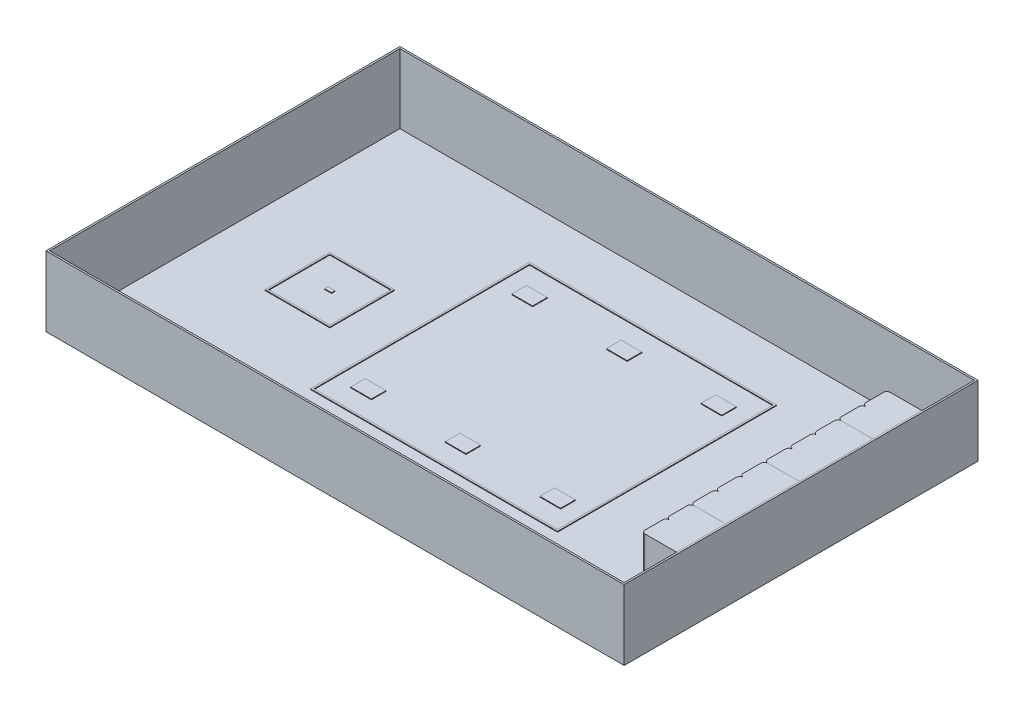
from build123d import *

# Parameters (mm, degrees)
SKETCH1_W                = 8200
SKETCH1_H                = 5000
SKETCH1_W_2              = 900
SKETCH1_H_2              = 900
SKETCH1_W_3              = 100
SKETCH1_H_3              = 50
SKETCH1_W_4              = 3500
SKETCH1_H_4              = 3100
SKETCH1_W_5              = 297
SKETCH1_H_5              = 210
BOSS_EXTRUDE1_DEPTH      = 10
EXTRUDE_THIN1_DEPTH      = 10
EXTRUDE_THIN1_DEPTH_BACK = 10
EXTRUDE_THIN1_START      = 10
SKETCH1_4_W              = 925
SKETCH1_4_H              = 925
SKETCH1_4_W_2            = 875
SKETCH1_4_H_2            = 875
BOSS_EXTRUDE3_START      = 10
SKETCH1_5_W              = 100
SKETCH1_5_H              = 50
BOSS_EXTRUDE3_DEPTH      = 10
SKETCH1_6_W              = 8250
SKETCH1_6_H              = 5050
SKETCH1_6_W_2            = 8200
SKETCH1_6_H_2            = 5000
EXTRUDE_THIN2_DEPTH      = 1000
BOSS_EXTRUDE4_START      = 10
SKETCH1_7_W              = 297
SKETCH1_7_H              = 210
BOSS_EXTRUDE4_DEPTH      = 10
BOSS_EXTRUDE4_2_DEPTH    = 10
BOSS_EXTRUDE4_3_DEPTH    = 10
BOSS_EXTRUDE4_4_DEPTH    = 10
BOSS_EXTRUDE4_5_DEPTH    = 10
BOSS_EXTRUDE4_6_DEPTH    = 10
BOSS_EXTRUDE6_START      = 10
BOSS_EXTRUDE6_DEPTH      = 990
BOSS_EXTRUDE7_START      = 10
BOSS_EXTRUDE7_DEPTH      = 990
BOSS_EXTRUDE8_START      = 10
BOSS_EXTRUDE8_DEPTH      = 990
BOSS_EXTRUDE9_START      = 10
BOSS_EXTRUDE9_DEPTH      = 990
EXTRUDE_THIN3_START      = 10
SKETCH1_12_W             = 3525
SKETCH1_12_H             = 3125
SKETCH1_12_W_2           = 3475
SKETCH1_12_H_2           = 3075
EXTRUDE_THIN3_DEPTH      = 10


with BuildPart() as part:
    # Sketch1 → Boss-Extrude1 (new body)
    # profile 1 of 20: a face of its own
    with BuildSketch(Plane(origin=(0, 0, 0), x_dir=(1, 0, 0), z_dir=(0, 1, 0))):
        with Locations((2600, 0)):
            Rectangle(SKETCH1_W, SKETCH1_H)
        Rectangle(SKETCH1_W_2, SKETCH1_H_2, mode=Mode.SUBTRACT)
    # profile 2 of 20: a face of its own
    with BuildSketch(Plane(origin=(0, 0, 0), x_dir=(1, 0, 0), z_dir=(0, 1, 0))):
        Rectangle(SKETCH1_W_2, SKETCH1_H_2)
    # profile 3 of 20: a face of its own
    with BuildSketch(Plane(origin=(0, 0, 0), x_dir=(1, 0, 0), z_dir=(0, 1, 0))):
        Rectangle(SKETCH1_W_3, SKETCH1_H_3)
    # profile 4 of 20: a face of its own
    with BuildSketch(Plane(origin=(0, 0, 0), x_dir=(1, 0, 0), z_dir=(0, 1, 0))):
        with BuildLine():
            Line((6250, -1750), (6700, -1750))
            Line((6700, -1750), (6700, -1400))
            Line((6700, -1400), (6250, -1400))
            ThreePointArc((6250, -1400), (6214.64466094, -1414.64466094), (6200, -1450))
            Line((6200, -1450), (6200, -1700))
            ThreePointArc((6200, -1700), (6214.64466094, -1735.355339059), (6250, -1750))
        make_face()
    # profile 5 of 20: a face of its own
    with BuildSketch(Plane(origin=(0, 0, 0), x_dir=(1, 0, 0), z_dir=(0, 1, 0))):
        with BuildLine():
            Line((6250, -1400), (6700, -1400))
            Line((6700, -1400), (6700, -1050))
            Line((6700, -1050), (6250, -1050))
            ThreePointArc((6250, -1050), (6214.64466094, -1064.64466094), (6200, -1100))
            Line((6200, -1100), (6200, -1350))
            ThreePointArc((6200, -1350), (6214.64466094, -1385.355339059), (6250, -1400))
        make_face()
    # profile 6 of 20: a face of its own
    with BuildSketch(Plane(origin=(0, 0, 0), x_dir=(1, 0, 0), z_dir=(0, 1, 0))):
        with BuildLine():
            Line((6250, -1050), (6700, -1050))
            Line((6700, -1050), (6700, -700))
            Line((6700, -700), (6250, -700))
            ThreePointArc((6250, -700), (6214.644660941, -714.64466094), (6200, -750))
            Line((6200, -750), (6200, -1000))
            ThreePointArc((6200, -1000), (6214.644660941, -1035.355339059), (6250, -1050))
        make_face()
    # profile 7 of 20: a face of its own
    with BuildSketch(Plane(origin=(0, 0, 0), x_dir=(1, 0, 0), z_dir=(0, 1, 0))):
        with BuildLine():
            Line((6250, -700), (6700, -700))
            Line((6700, -700), (6700, -350))
            Line((6700, -350), (6250, -350))
            ThreePointArc((6250, -350), (6214.644660941, -364.64466094), (6200, -400))
            Line((6200, -400), (6200, -650))
            ThreePointArc((6200, -650), (6214.644660941, -685.355339059), (6250, -700))
        make_face()
    # profile 8 of 20: a face of its own
    with BuildSketch(Plane(origin=(0, 0, 0), x_dir=(1, 0, 0), z_dir=(0, 1, 0))):
        with BuildLine():
            Line((6250, -350), (6700, -350))
            Line((6700, -350), (6700, 0))
            Line((6700, 0), (6250, 0))
            ThreePointArc((6250, 0), (6214.644660941, -14.64466094), (6200, -50))
            Line((6200, -50), (6200, -300))
            ThreePointArc((6200, -300), (6214.644660941, -335.355339059), (6250, -350))
        make_face()
    # profile 9 of 20: a face of its own
    with BuildSketch(Plane(origin=(0, 0, 0), x_dir=(1, 0, 0), z_dir=(0, 1, 0))):
        with BuildLine():
            Line((6250, 0), (6700, 0))
            Line((6700, 0), (6700, 350))
            Line((6700, 350), (6250, 350))
            ThreePointArc((6250, 350), (6214.644660941, 335.35533906), (6200, 300))
            Line((6200, 300), (6200, 50))
            ThreePointArc((6200, 50), (6214.644660941, 14.644660941), (6250, 0))
        make_face()
    # profile 10 of 20: a face of its own
    with BuildSketch(Plane(origin=(0, 0, 0), x_dir=(1, 0, 0), z_dir=(0, 1, 0))):
        with BuildLine():
            Line((6700, 350), (6700, 700))
            Line((6700, 700), (6250, 700))
            ThreePointArc((6250, 700), (6214.644660941, 685.35533906), (6200, 650))
            Line((6200, 650), (6200, 400))
            ThreePointArc((6200, 400), (6214.644660941, 364.644660941), (6250, 350))
            Line((6250, 350), (6700, 350))
        make_face()
    # profile 11 of 20: a face of its own
    with BuildSketch(Plane(origin=(0, 0, 0), x_dir=(1, 0, 0), z_dir=(0, 1, 0))):
        with BuildLine():
            Line((6700, 1400), (6700, 1750))
            Line((6700, 1750), (6250, 1750))
            ThreePointArc((6250, 1750), (6214.644660941, 1735.35533906), (6200, 1700))
            Line((6200, 1700), (6200, 1450))
            ThreePointArc((6200, 1450), (6214.644660941, 1414.644660941), (6250, 1400))
            Line((6250, 1400), (6700, 1400))
        make_face()
    # profile 12 of 20: a face of its own
    with BuildSketch(Plane(origin=(0, 0, 0), x_dir=(1, 0, 0), z_dir=(0, 1, 0))):
        with BuildLine():
            Line((6700, 1050), (6700, 1400))
            Line((6700, 1400), (6250, 1400))
            ThreePointArc((6250, 1400), (6214.644660941, 1385.35533906), (6200, 1350))
            Line((6200, 1350), (6200, 1100))
            ThreePointArc((6200, 1100), (6214.644660941, 1064.644660941), (6250, 1050))
            Line((6250, 1050), (6700, 1050))
        make_face()
    # profile 13 of 20: a face of its own
    with BuildSketch(Plane(origin=(0, 0, 0), x_dir=(1, 0, 0), z_dir=(0, 1, 0))):
        with BuildLine():
            Line((6700, 700), (6700, 1050))
            Line((6700, 1050), (6250, 1050))
            ThreePointArc((6250, 1050), (6214.644660941, 1035.35533906), (6200, 1000))
            Line((6200, 1000), (6200, 750))
            ThreePointArc((6200, 750), (6214.644660941, 714.644660941), (6250, 700))
            Line((6250, 700), (6700, 700))
        make_face()
    # profile 14 of 20: a face of its own
    with BuildSketch(Plane(origin=(0, 0, 0), x_dir=(1, 0, 0), z_dir=(0, 1, 0))):
        with Locations((2850, 200)):
            Rectangle(SKETCH1_W_4, SKETCH1_H_4)
        with Locations((4200, -950)):
            Rectangle(SKETCH1_W_5, SKETCH1_H_5, mode=Mode.SUBTRACT)
        with Locations((2850, -950)):
            Rectangle(SKETCH1_W_5, SKETCH1_H_5, mode=Mode.SUBTRACT)
        with Locations((1500, -950)):
            Rectangle(SKETCH1_W_5, SKETCH1_H_5, mode=Mode.SUBTRACT)
        with Locations((4200, 1350)):
            Rectangle(SKETCH1_W_5, SKETCH1_H_5, mode=Mode.SUBTRACT)
        with Locations((2850, 1350)):
            Rectangle(SKETCH1_W_5, SKETCH1_H_5, mode=Mode.SUBTRACT)
        with Locations((1500, 1350)):
            Rectangle(SKETCH1_W_5, SKETCH1_H_5, mode=Mode.SUBTRACT)
    # profile 15 of 20: a face of its own
    with BuildSketch(Plane(origin=(0, 0, 0), x_dir=(1, 0, 0), z_dir=(0, 1, 0))):
        with Locations((1500, 1350)):
            Rectangle(SKETCH1_W_5, SKETCH1_H_5)
    # profile 16 of 20: a face of its own
    with BuildSketch(Plane(origin=(0, 0, 0), x_dir=(1, 0, 0), z_dir=(0, 1, 0))):
        with Locations((2850, 1350)):
            Rectangle(SKETCH1_W_5, SKETCH1_H_5)
    # profile 17 of 20: a face of its own
    with BuildSketch(Plane(origin=(0, 0, 0), x_dir=(1, 0, 0), z_dir=(0, 1, 0))):
        with Locations((4200, 1350)):
            Rectangle(SKETCH1_W_5, SKETCH1_H_5)
    # profile 18 of 20: a face of its own
    with BuildSketch(Plane(origin=(0, 0, 0), x_dir=(1, 0, 0), z_dir=(0, 1, 0))):
        with Locations((4200, -950)):
            Rectangle(SKETCH1_W_5, SKETCH1_H_5)
    # profile 19 of 20: a face of its own
    with BuildSketch(Plane(origin=(0, 0, 0), x_dir=(1, 0, 0), z_dir=(0, 1, 0))):
        with Locations((2850, -950)):
            Rectangle(SKETCH1_W_5, SKETCH1_H_5)
    # profile 20 of 20: a face of its own
    with BuildSketch(Plane(origin=(0, 0, 0), x_dir=(1, 0, 0), z_dir=(0, 1, 0))):
        with Locations((1500, -950)):
            Rectangle(SKETCH1_W_5, SKETCH1_H_5)
    extrude(amount=BOSS_EXTRUDE1_DEPTH)


with BuildPart() as body_2:
    # Sketch1<4> → Extrude-Thin1 (new, two sides: drawn at the far end of the back side and taken through both)
    with BuildSketch(Plane(origin=(0, 0, 0), x_dir=(1, 0, 0), z_dir=(0, 1, 0)).offset(EXTRUDE_THIN1_START - EXTRUDE_THIN1_DEPTH_BACK)):
        Rectangle(SKETCH1_4_W, SKETCH1_4_H)
        Rectangle(SKETCH1_4_W_2, SKETCH1_4_H_2, mode=Mode.SUBTRACT)
    extrude(amount=EXTRUDE_THIN1_DEPTH + EXTRUDE_THIN1_DEPTH_BACK)


with BuildPart() as body_3:
    # Sketch1<5> → Boss-Extrude3 (new body)
    with BuildSketch(Plane(origin=(0, 0, 0), x_dir=(1, 0, 0), z_dir=(0, 1, 0)).offset(BOSS_EXTRUDE3_START)):
        Rectangle(SKETCH1_5_W, SKETCH1_5_H)
    extrude(amount=BOSS_EXTRUDE3_DEPTH)


with BuildPart() as body_4:
    # Sketch1<6> → Extrude-Thin2 (new body)
    with BuildSketch(Plane(origin=(0, 0, 0), x_dir=(1, 0, 0), z_dir=(0, 1, 0))):
        with Locations((2600, 0)):
            Rectangle(SKETCH1_6_W, SKETCH1_6_H)
        with Locations((2600, 0)):
            Rectangle(SKETCH1_6_W_2, SKETCH1_6_H_2, mode=Mode.SUBTRACT)
    extrude(amount=EXTRUDE_THIN2_DEPTH)


with BuildPart() as body_5:
    # Sketch1<7> → Boss-Extrude4 (new body)
    with BuildSketch(Plane(origin=(0, 0, 0), x_dir=(1, 0, 0), z_dir=(0, 1, 0)).offset(BOSS_EXTRUDE4_START)):
        with Locations((2850, -950)):
            Rectangle(SKETCH1_7_W, SKETCH1_7_H)
    extrude(amount=BOSS_EXTRUDE4_DEPTH)


with BuildPart() as body_6:
    # Sketch1<7> → Boss-Extrude4 2 (new body)
    with BuildSketch(Plane(origin=(0, 0, 0), x_dir=(1, 0, 0), z_dir=(0, 1, 0)).offset(BOSS_EXTRUDE4_START)):
        with Locations((1500, -950)):
            Rectangle(SKETCH1_7_W, SKETCH1_7_H)
    extrude(amount=BOSS_EXTRUDE4_2_DEPTH)


with BuildPart() as body_7:
    # Sketch1<7> → Boss-Extrude4 3 (new body)
    with BuildSketch(Plane(origin=(0, 0, 0), x_dir=(1, 0, 0), z_dir=(0, 1, 0)).offset(BOSS_EXTRUDE4_START)):
        with Locations((1500, 1350)):
            Rectangle(SKETCH1_7_W, SKETCH1_7_H)
    extrude(amount=BOSS_EXTRUDE4_3_DEPTH)


with BuildPart() as body_8:
    # Sketch1<7> → Boss-Extrude4 4 (new body)
    with BuildSketch(Plane(origin=(0, 0, 0), x_dir=(1, 0, 0), z_dir=(0, 1, 0)).offset(BOSS_EXTRUDE4_START)):
        with Locations((2850, 1350)):
            Rectangle(SKETCH1_7_W, SKETCH1_7_H)
    extrude(amount=BOSS_EXTRUDE4_4_DEPTH)


with BuildPart() as body_9:
    # Sketch1<7> → Boss-Extrude4 5 (new body)
    with BuildSketch(Plane(origin=(0, 0, 0), x_dir=(1, 0, 0), z_dir=(0, 1, 0)).offset(BOSS_EXTRUDE4_START)):
        with Locations((4200, 1350)):
            Rectangle(SKETCH1_7_W, SKETCH1_7_H)
    extrude(amount=BOSS_EXTRUDE4_5_DEPTH)


with BuildPart() as body_10:
    # Sketch1<7> → Boss-Extrude4 6 (new body)
    with BuildSketch(Plane(origin=(0, 0, 0), x_dir=(1, 0, 0), z_dir=(0, 1, 0)).offset(BOSS_EXTRUDE4_START)):
        with Locations((4200, -950)):
            Rectangle(SKETCH1_7_W, SKETCH1_7_H)
    extrude(amount=BOSS_EXTRUDE4_6_DEPTH)


with BuildPart() as body_11:
    # Sketch1<8> → Boss-Extrude6 (new body)
    with BuildSketch(Plane(origin=(0, 0, 0), x_dir=(1, 0, 0), z_dir=(0, 1, 0)).offset(BOSS_EXTRUDE6_START)):
        with BuildLine():
            Line((6700, 1400), (6700, 1750))
            Line((6700, 1750), (6250, 1750))
            ThreePointArc((6250, 1750), (6214.644660941, 1735.35533906), (6200, 1700))
            Line((6200, 1700), (6200, 1450))
            ThreePointArc((6200, 1450), (6214.644660941, 1414.644660941), (6250, 1400))
            Line((6250, 1400), (6700, 1400))
        make_face()
        with BuildLine():
            Line((6700, 1050), (6700, 1400))
            Line((6700, 1400), (6250, 1400))
            ThreePointArc((6250, 1400), (6214.644660941, 1385.35533906), (6200, 1350))
            Line((6200, 1350), (6200, 1100))
            ThreePointArc((6200, 1100), (6214.644660941, 1064.644660941), (6250, 1050))
            Line((6250, 1050), (6700, 1050))
        make_face()
    extrude(amount=BOSS_EXTRUDE6_DEPTH)


with BuildPart() as body_12:
    # Sketch1<9> → Boss-Extrude7 (new body)
    with BuildSketch(Plane(origin=(0, 0, 0), x_dir=(1, 0, 0), z_dir=(0, 1, 0)).offset(BOSS_EXTRUDE7_START)):
        with BuildLine():
            Line((6700, 700), (6700, 1050))
            Line((6700, 1050), (6250, 1050))
            ThreePointArc((6250, 1050), (6214.644660941, 1035.35533906), (6200, 1000))
            Line((6200, 1000), (6200, 750))
            ThreePointArc((6200, 750), (6214.644660941, 714.644660941), (6250, 700))
            Line((6250, 700), (6700, 700))
        make_face()
        with BuildLine():
            Line((6700, 350), (6700, 700))
            Line((6700, 700), (6250, 700))
            ThreePointArc((6250, 700), (6214.644660941, 685.35533906), (6200, 650))
            Line((6200, 650), (6200, 400))
            ThreePointArc((6200, 400), (6214.644660941, 364.644660941), (6250, 350))
            Line((6250, 350), (6700, 350))
        make_face()
        with BuildLine():
            Line((6250, 0), (6700, 0))
            Line((6700, 0), (6700, 350))
            Line((6700, 350), (6250, 350))
            ThreePointArc((6250, 350), (6214.644660941, 335.35533906), (6200, 300))
            Line((6200, 300), (6200, 50))
            ThreePointArc((6200, 50), (6214.644660941, 14.644660941), (6250, 0))
        make_face()
    extrude(amount=BOSS_EXTRUDE7_DEPTH)


with BuildPart() as body_13:
    # Sketch1<10> → Boss-Extrude8 (new body)
    with BuildSketch(Plane(origin=(0, 0, 0), x_dir=(1, 0, 0), z_dir=(0, 1, 0)).offset(BOSS_EXTRUDE8_START)):
        with BuildLine():
            Line((6250, -700), (6700, -700))
            Line((6700, -700), (6700, -350))
            Line((6700, -350), (6250, -350))
            ThreePointArc((6250, -350), (6214.644660941, -364.64466094), (6200, -400))
            Line((6200, -400), (6200, -650))
            ThreePointArc((6200, -650), (6214.644660941, -685.355339059), (6250, -700))
        make_face()
        with BuildLine():
            Line((6250, -350), (6700, -350))
            Line((6700, -350), (6700, 0))
            Line((6700, 0), (6250, 0))
            ThreePointArc((6250, 0), (6214.644660941, -14.64466094), (6200, -50))
            Line((6200, -50), (6200, -300))
            ThreePointArc((6200, -300), (6214.644660941, -335.355339059), (6250, -350))
        make_face()
        with BuildLine():
            Line((6250, -1050), (6700, -1050))
            Line((6700, -1050), (6700, -700))
            Line((6700, -700), (6250, -700))
            ThreePointArc((6250, -700), (6214.644660941, -714.64466094), (6200, -750))
            Line((6200, -750), (6200, -1000))
            ThreePointArc((6200, -1000), (6214.644660941, -1035.355339059), (6250, -1050))
        make_face()
    extrude(amount=BOSS_EXTRUDE8_DEPTH)


with BuildPart() as body_14:
    # Sketch1<11> → Boss-Extrude9 (new body)
    with BuildSketch(Plane(origin=(0, 0, 0), x_dir=(1, 0, 0), z_dir=(0, 1, 0)).offset(BOSS_EXTRUDE9_START)):
        with BuildLine():
            Line((6250, -1400), (6700, -1400))
            Line((6700, -1400), (6700, -1050))
            Line((6700, -1050), (6250, -1050))
            ThreePointArc((6250, -1050), (6214.64466094, -1064.64466094), (6200, -1100))
            Line((6200, -1100), (6200, -1350))
            ThreePointArc((6200, -1350), (6214.64466094, -1385.355339059), (6250, -1400))
        make_face()
        with BuildLine():
            Line((6250, -1750), (6700, -1750))
            Line((6700, -1750), (6700, -1400))
            Line((6700, -1400), (6250, -1400))
            ThreePointArc((6250, -1400), (6214.64466094, -1414.64466094), (6200, -1450))
            Line((6200, -1450), (6200, -1700))
            ThreePointArc((6200, -1700), (6214.64466094, -1735.355339059), (6250, -1750))
        make_face()
    extrude(amount=BOSS_EXTRUDE9_DEPTH)


with BuildPart() as body_15:
    # Sketch1<12> → Extrude-Thin3 (new body)
    with BuildSketch(Plane(origin=(0, 0, 0), x_dir=(1, 0, 0), z_dir=(0, 1, 0)).offset(EXTRUDE_THIN3_START)):
        with Locations((2850, 200)):
            Rectangle(SKETCH1_12_W, SKETCH1_12_H)
        with Locations((2850, 200)):
            Rectangle(SKETCH1_12_W_2, SKETCH1_12_H_2, mode=Mode.SUBTRACT)
    extrude(amount=EXTRUDE_THIN3_DEPTH)


solid = Compound([part.part, body_2.part, body_3.part, body_4.part, body_5.part, body_6.part, body_7.part, body_8.part, body_9.part, body_10.part, body_11.part, body_12.part, body_13.part, body_14.part, body_15.part])
